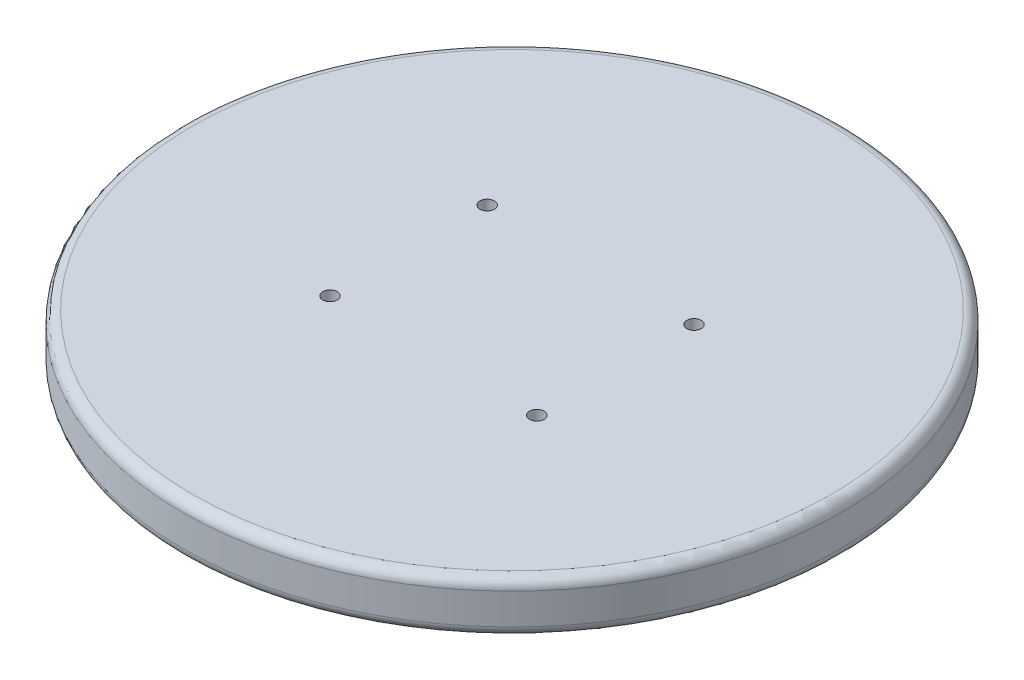
from build123d import *

# Parameters (mm, degrees)
SKETCH1_R           = 63.737542135
SKETCH1_R_2         = 1.4
BOSS_EXTRUDE1_DEPTH = 10
FILLET1_R           = 2
FILLET2_R           = 2


with BuildPart() as part:
    # Sketch1 → Boss-Extrude1 (new body)
    with BuildSketch(Plane(origin=(0, 0, 0), x_dir=(1, 0, 0), z_dir=(0, 1, 0))):
        with Locations(Location((0, 0, 0), (0, 0, 270))):
            Circle(SKETCH1_R)
        with Locations(Location((20, 15.2, 0), (0, 0, 270))):
            Circle(SKETCH1_R_2, mode=Mode.SUBTRACT)
        with Locations(Location((20, -15.2, 0), (0, 0, 270))):
            Circle(SKETCH1_R_2, mode=Mode.SUBTRACT)
        with Locations(Location((-20, -15.2, 0), (0, 0, 90))):
            Circle(SKETCH1_R_2, mode=Mode.SUBTRACT)
        with Locations(Location((-20, 15.2, 0), (0, 0, 90))):
            Circle(SKETCH1_R_2, mode=Mode.SUBTRACT)
    extrude(amount=BOSS_EXTRUDE1_DEPTH)

    # Fillet1
    fillet1_edges = [part.edges().sort_by_distance(p)[0] for p in [
        (0, 0, -63.737542135),
    ]]
    fillet(fillet1_edges, radius=FILLET1_R)

    # Fillet2
    fillet2_edges = [part.edges().sort_by_distance(p)[0] for p in [
        (0, 10, -63.737542135),
    ]]
    fillet(fillet2_edges, radius=FILLET2_R)


solid = part.part
